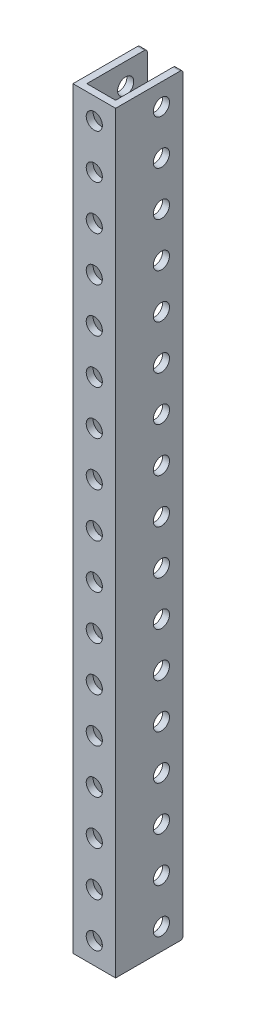
from build123d import *

# Parameters (mm, degrees)
SKETCH1_W                 = 165.989
SKETCH1_H                 = 14.859
BOSS_EXTRUDE1_DEPTH       = 9.398
SKETCH2_W                 = 6.35
SKETCH2_H                 = 13.335
CUT_EXTRUDE1_DEPTH        = 167.590068573
F_5_CLEARANCE_HOLE1_D     = 3.556
F_5_CLEARANCE_HOLE1_DEPTH = 1.524
F_5_CLEARANCE_HOLE2_D     = 3.556
F_5_CLEARANCE_HOLE2_DEPTH = 14.859
F_5_CLEARANCE_HOLE3_D     = 3.556
FILLET1_R                 = 0.635


with BuildPart() as part:
    # Sketch1 → Boss-Extrude1 (new body)
    with BuildSketch(Plane(origin=(-4.699, 0, 0), x_dir=(0, -1, 0), z_dir=(-1, 0, 0))):
        with Locations((-82.9945, -5.9055)):
            Rectangle(SKETCH1_W, SKETCH1_H)
    extrude(amount=-BOSS_EXTRUDE1_DEPTH)

    # Sketch2 → Cut-Extrude1 (cut, through all)
    with BuildSketch(Plane.XZ):
        with Locations((0, -6.6675)):
            Rectangle(SKETCH2_W, SKETCH2_H)
    extrude(amount=-CUT_EXTRUDE1_DEPTH, mode=Mode.SUBTRACT)

    # #5 Clearance Hole1
    with Locations(Plane(origin=(4.699, 0, 0), x_dir=(0, 0, -1), z_dir=(1, 0, 0))):
        with Locations((8.5725, 151.4475), (8.5725, 161.2265), (8.5725, 141.6685), (8.5725, 131.8895), (8.5725, 122.1105), (8.5725, 112.3315), (8.5725, 102.5525), (8.5725, 92.7735), (8.5725, 82.9945), (8.5725, 73.2155), (8.5725, 63.4365), (8.5725, 53.6575), (8.5725, 43.8785), (8.5725, 34.0995), (8.5725, 24.3205), (8.5725, 14.5415), (8.5725, 4.7625)):
            Hole(F_5_CLEARANCE_HOLE1_D / 2, depth=F_5_CLEARANCE_HOLE1_DEPTH)

    # #5 Clearance Hole2
    with Locations(Plane.XY.offset(1.524)):
        with Locations((0, 151.4475), (0, 161.2265), (0, 141.6685), (0, 131.8895), (0, 122.1105), (0, 112.3315), (0, 102.5525), (0, 92.7735), (0, 82.9945), (0, 73.2155), (0, 63.4365), (0, 53.6575), (0, 43.8785), (0, 34.0995), (0, 24.3205), (0, 14.5415), (0, 4.7625)):
            Hole(F_5_CLEARANCE_HOLE2_D / 2, depth=F_5_CLEARANCE_HOLE2_DEPTH)

    # #5 Clearance Hole3 (through all)
    with Locations(Plane(origin=(-3.175, 0, 0), x_dir=(0, 0, -1), z_dir=(1, 0, 0))):
        with Locations((8.5725, 151.4475), (8.5725, 161.2265), (8.5725, 141.6685), (8.5725, 131.8895), (8.5725, 122.1105), (8.5725, 112.3315), (8.5725, 102.5525), (8.5725, 92.7735), (8.5725, 82.9945), (8.5725, 73.2155), (8.5725, 63.4365), (8.5725, 53.6575), (8.5725, 43.8785), (8.5725, 34.0995), (8.5725, 24.3205), (8.5725, 14.5415), (8.5725, 4.7625)):
            Hole(F_5_CLEARANCE_HOLE3_D / 2)

    # Fillet1
    fillet1_edges = [part.edges().sort_by_distance(p)[0] for p in [
        (-3.937, 165.989, -13.335),
        (-3.937, 0, -13.335),
        (3.937, 0, -13.335),
        (3.937, 165.989, -13.335),
    ]]
    fillet(fillet1_edges, radius=FILLET1_R)


solid = part.part
